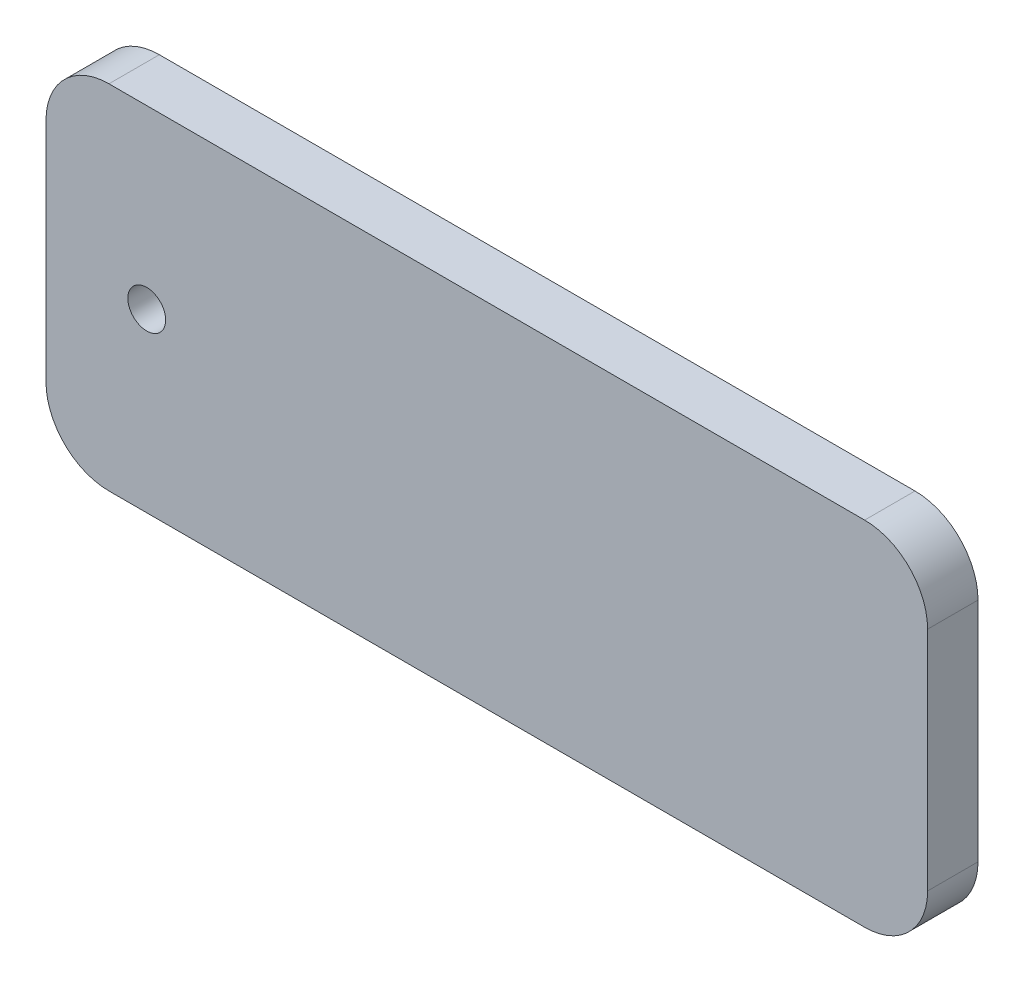
from build123d import *

# Parameters (mm, degrees)
SKETCH1_R           = 1.5
BOSS_EXTRUDE1_DEPTH = 4


with BuildPart() as part:
    # Sketch1 → Boss-Extrude1 (new body)
    with BuildSketch(Plane.XY):
        with BuildLine():
            Line((5, 0), (65, 0))
            ThreePointArc((65, 0), (68.535533906, 1.464466094), (70, 5))
            Line((70, 5), (70, 23))
            ThreePointArc((70, 23), (68.535533906, 26.535533906), (65, 28))
            Line((65, 28), (5, 28))
            ThreePointArc((5, 28), (1.464466094, 26.535533906), (0, 23))
            Line((0, 23), (0, 5))
            ThreePointArc((0, 5), (1.464466094, 1.464466094), (5, 0))
        make_face()
        with Locations((8, 14)):
            Circle(SKETCH1_R, mode=Mode.SUBTRACT)
    extrude(amount=BOSS_EXTRUDE1_DEPTH)


solid = part.part
